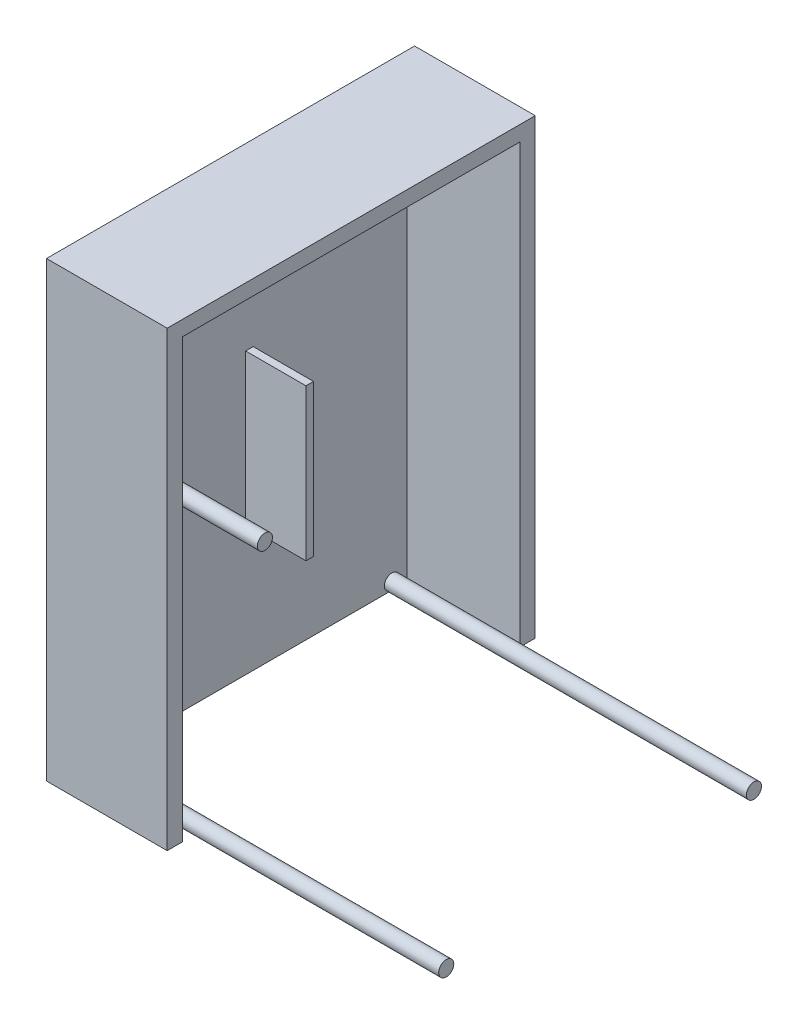
from build123d import *

# Parameters (mm, degrees)
SKETCH1_W           = 142.24
SKETCH1_H           = 184.15
BOSS_EXTRUDE1_DEPTH = 3.175
BOSS_EXTRUDE2_DEPTH = 50.8
SKETCH3_R           = 3.175
BOSS_EXTRUDE3_DEPTH = 152.4
SKETCH4_R           = 3.175
BOSS_EXTRUDE5_DEPTH = 47.625
SKETCH5_W           = 3.175
SKETCH5_H           = 63.808036069
BOSS_EXTRUDE6_DEPTH = 25.4


with BuildPart() as part:
    # Sketch1 → Boss-Extrude1 (new body)
    with BuildSketch(Plane(origin=(0, 0, 0), x_dir=(0, 0, -1), z_dir=(1, 0, 0))):
        with Locations((-0.521497585, -4.635193237)):
            Rectangle(SKETCH1_W, SKETCH1_H)
    extrude(amount=BOSS_EXTRUDE1_DEPTH)

    # Sketch2 → Boss-Extrude2 (add)
    with BuildSketch(Plane.ZY):
        Polygon((71.641497585, -96.710193237), (77.991497585, -96.710193237), (77.991497585, 93.789806763), (-76.948502415, 93.789806763), (-76.948502415, -96.710193237), (-70.598502415, -96.710193237), (-70.598502415, 87.439806763), (71.641497585, 87.439806763), align=None)
    extrude(amount=-BOSS_EXTRUDE2_DEPTH)

    # Sketch3 → Boss-Extrude3 (add)
    with BuildSketch(Plane(origin=(3.175, 0, 0), x_dir=(0, 0, -1), z_dir=(1, 0, 0))):
        with Locations(Location((-65.291497585, -93.535193237, 0), (0, 0, 270))):
            Circle(SKETCH3_R)
        with Locations(Location((64.248502415, -93.535193237, 0), (0, 0, 270))):
            Circle(SKETCH3_R)
    extrude(amount=BOSS_EXTRUDE3_DEPTH)

    # Sketch4 → Boss-Extrude5 (add)
    with BuildSketch(Plane(origin=(3.175, 0, 0), x_dir=(0, 0, -1), z_dir=(1, 0, 0))):
        with Locations((-36.845275585, -4.635193237)):
            Circle(SKETCH4_R)
    extrude(amount=BOSS_EXTRUDE5_DEPTH)

    # Sketch5 → Boss-Extrude6 (add)
    with BuildSketch(Plane(origin=(3.175, 0, 0), x_dir=(0, 0, -1), z_dir=(1, 0, 0))):
        with Locations((4.241002415, -10.555636975)):
            Rectangle(SKETCH5_W, SKETCH5_H)
    extrude(amount=BOSS_EXTRUDE6_DEPTH)


solid = part.part
